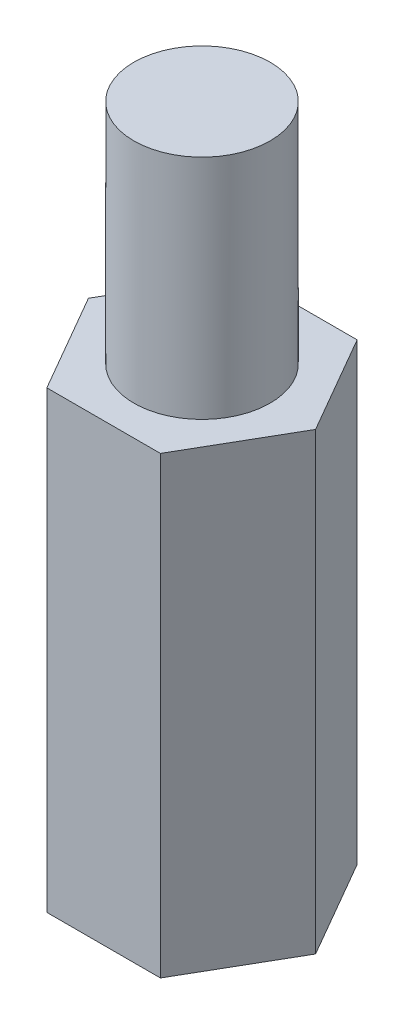
from build123d import *

# Parameters (mm, degrees)
EXTRUDE_1_DEPTH     = 10
SKETCH_2_R          = 1.5
EXTRUDE_2_DEPTH     = 5
SKETCH_3_R          = 1.5
CUT_EXTRUDE_1_DEPTH = 10


with BuildPart() as part:
    # Эскиз1 → Бобышка-Вытянуть1 (new body)
    with BuildSketch(Plane(origin=(0, 0, 0), x_dir=(1, 0, 0), z_dir=(0, 1, 0))):
        Polygon((1.25, -2.165063509), (2.5, 0), (1.25, 2.165063509), (-1.25, 2.165063509), (-2.5, 0), (-1.25, -2.165063509), align=None)
    extrude(amount=EXTRUDE_1_DEPTH)

    # Эскиз2 → Бобышка-Вытянуть2 (add)
    with BuildSketch(Plane(origin=(0, 10, 0), x_dir=(1, 0, 0), z_dir=(0, 1, 0))):
        with Locations(Location((0, 0, 0), (0, 0, 270))):
            Circle(SKETCH_2_R)
    extrude(amount=EXTRUDE_2_DEPTH)

    # Эскиз3 → Вырез-Вытянуть1 (cut)
    with BuildSketch(Plane.XZ):
        with Locations(Location((0, 0, 0), (0, 0, 270))):
            Circle(SKETCH_3_R)
    extrude(amount=-CUT_EXTRUDE_1_DEPTH, mode=Mode.SUBTRACT)


with BuildPart() as cut_extrude_1_piece_1:
    # of the separate pieces the step leaves, piece 1, a body of its own (cut_extrude_1_pieces)
    add(part.part.solids().sort_by_distance((1.25, 0, 2.165063509))[0])


with BuildPart() as cut_extrude_1_piece_2:
    # of the separate pieces the step leaves, piece 2, a body of its own (cut_extrude_1_pieces)
    add(part.part.solids().sort_by_distance((0, 15, 1.5))[0])


solid = Compound([cut_extrude_1_piece_1.part, cut_extrude_1_piece_2.part])
